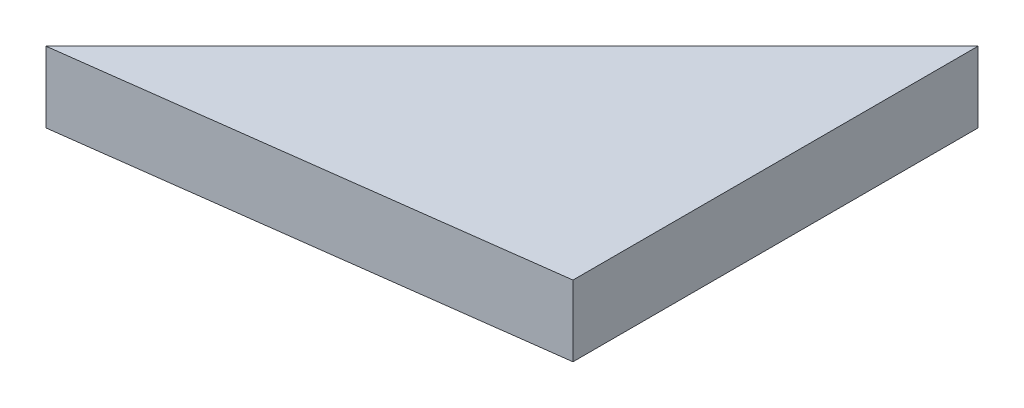
from build123d import *

# Parameters (mm, degrees)
BOSS_EXTRUDE1_DEPTH = 3.175


with BuildPart() as part:
    # Sketch1 → Boss-Extrude1 (new body)
    with BuildSketch(Plane(origin=(0, 0, 0), x_dir=(1, 0, 0), z_dir=(0, 1, 0))):
        Polygon((0, 0), (0, 18.160519686), (-20.8946606, -2.734140914), align=None)
    extrude(amount=BOSS_EXTRUDE1_DEPTH)


solid = part.part
